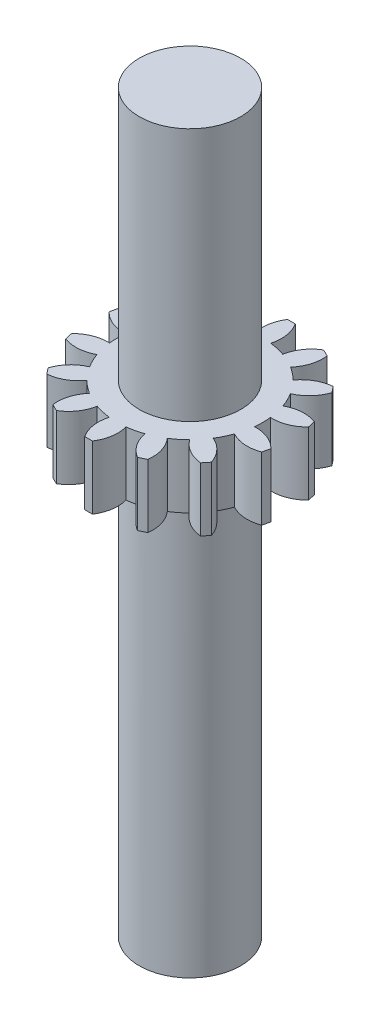
from build123d import *

# Parameters (mm, degrees)
SKETCH1_R                = 0.4
BOSS_EXTRUDE1_DEPTH      = 5
BOSS_EXTRUDE2_DEPTH      = 33
BOSS_EXTRUDE2_DEPTH_BACK = 5
SKETCH2_R                = 4
BOSS_EXTRUDE3_START      = 20
SKETCH3_R                = 4
BOSS_EXTRUDE3_DEPTH      = 20
CUT_EXTRUDE1_DEPTH       = 33


with BuildPart() as part:
    # Sketch1 → Boss-Extrude1 (new body)
    with BuildSketch(Plane(origin=(0, 0, 0), x_dir=(1, 0, 0), z_dir=(0, 1, 0))):
        with BuildLine():
            ThreePointArc((3.744900382, -7.069350828), (3.64692573, -5.891768521), (3.071904032, -4.859465672))
            ThreePointArc((3.071904032, -4.859465672), (3.584442871, -4.494749193), (4.054065768, -4.076217824))
            ThreePointArc((4.054065768, -4.076217824), (4.932532263, -4.866531521), (6.058788713, -5.224086459))
            ThreePointArc((6.058788713, -5.224086459), (6.25465186, -4.987918415), (6.441315028, -4.744413632))
            ThreePointArc((6.441315028, -4.744413632), (5.842109102, -3.725958242), (4.876133034, -3.045378078))
            ThreePointArc((4.876133034, -3.045378078), (5.179670022, -2.494397616), (5.421191676, -1.913552144))
            ThreePointArc((5.421191676, -1.913552144), (6.555566902, -2.244447854), (7.725426174, -2.077929362))
            ThreePointArc((7.725426174, -2.077929362), (7.799423297, -1.780167472), (7.861948235, -1.47978713))
            ThreePointArc((7.861948235, -1.47978713), (6.880191117, -0.822176238), (5.714584087, -0.628116006))
            ThreePointArc((5.714584087, -0.628116006), (5.749, 0), (5.714584087, 0.628116006))
            ThreePointArc((5.714584087, 0.628116006), (6.880191117, 0.822176238), (7.861948235, 1.47978713))
            ThreePointArc((7.861948235, 1.47978713), (7.799423297, 1.780167472), (7.725426174, 2.077929362))
            ThreePointArc((7.725426174, 2.077929362), (6.555566902, 2.244447854), (5.421191676, 1.913552144))
            ThreePointArc((5.421191676, 1.913552144), (5.179670022, 2.494397616), (4.876133034, 3.045378078))
            ThreePointArc((4.876133034, 3.045378078), (5.842109102, 3.725958242), (6.441315028, 4.744413632))
            ThreePointArc((6.441315028, 4.744413632), (6.25465186, 4.987918415), (6.058788713, 5.224086459))
            ThreePointArc((6.058788713, 5.224086459), (4.932532263, 4.866531521), (4.054065768, 4.076217824))
            ThreePointArc((4.054065768, 4.076217824), (3.584442871, 4.494749193), (3.071904032, 4.859465672))
            ThreePointArc((3.071904032, 4.859465672), (3.64692573, 5.891768521), (3.744900382, 7.069350828))
            ThreePointArc((3.744900382, 7.069350828), (3.471069913, 7.207750943), (3.192133841, 7.335549164))
            ThreePointArc((3.192133841, 7.335549164), (2.332549116, 6.524738937), (1.883982415, 5.431538572))
            ThreePointArc((1.883982415, 5.431538572), (1.279272849, 5.604860567), (0.659246762, 5.711076493))
            ThreePointArc((0.659246762, 5.711076493), (0.72942399, 6.890641786), (0.306762287, 7.994116393))
            ThreePointArc((0.306762287, 7.994116393), (0, 8), (-0.306762287, 7.994116393))
            ThreePointArc((-0.306762287, 7.994116393), (-0.72942399, 6.890641786), (-0.659246762, 5.711076493))
            ThreePointArc((-0.659246762, 5.711076493), (-1.279272849, 5.604860567), (-1.883982415, 5.431538572))
            ThreePointArc((-1.883982415, 5.431538572), (-2.332549116, 6.524738937), (-3.192133841, 7.335549164))
            ThreePointArc((-3.192133841, 7.335549164), (-3.471069913, 7.207750943), (-3.744900382, 7.069350828))
            ThreePointArc((-3.744900382, 7.069350828), (-3.64692573, 5.891768521), (-3.071904032, 4.859465672))
            ThreePointArc((-3.071904032, 4.859465672), (-3.584442871, 4.494749193), (-4.054065768, 4.076217824))
            ThreePointArc((-4.054065768, 4.076217824), (-4.932532263, 4.866531521), (-6.058788713, 5.224086459))
            ThreePointArc((-6.058788713, 5.224086459), (-6.25465186, 4.987918415), (-6.441315028, 4.744413632))
            ThreePointArc((-6.441315028, 4.744413632), (-5.842109102, 3.725958242), (-4.876133034, 3.045378078))
            ThreePointArc((-4.876133034, 3.045378078), (-5.179670022, 2.494397616), (-5.421191676, 1.913552144))
            ThreePointArc((-5.421191676, 1.913552144), (-6.555566902, 2.244447854), (-7.725426174, 2.077929362))
            ThreePointArc((-7.725426174, 2.077929362), (-7.799423297, 1.780167472), (-7.861948235, 1.47978713))
            ThreePointArc((-7.861948235, 1.47978713), (-6.880191117, 0.822176238), (-5.714584087, 0.628116006))
            ThreePointArc((-5.714584087, 0.628116006), (-5.749, 0), (-5.714584087, -0.628116006))
            ThreePointArc((-5.714584087, -0.628116006), (-6.880191117, -0.822176238), (-7.861948235, -1.47978713))
            ThreePointArc((-7.861948235, -1.47978713), (-7.799423297, -1.780167472), (-7.725426174, -2.077929362))
            ThreePointArc((-7.725426174, -2.077929362), (-6.555566902, -2.244447854), (-5.421191676, -1.913552144))
            ThreePointArc((-5.421191676, -1.913552144), (-5.179670022, -2.494397616), (-4.876133034, -3.045378078))
            ThreePointArc((-4.876133034, -3.045378078), (-5.842109102, -3.725958242), (-6.441315028, -4.744413632))
            ThreePointArc((-6.441315028, -4.744413632), (-6.25465186, -4.987918415), (-6.058788713, -5.224086459))
            ThreePointArc((-6.058788713, -5.224086459), (-4.932532263, -4.866531521), (-4.054065768, -4.076217824))
            ThreePointArc((-4.054065768, -4.076217824), (-3.584442871, -4.494749193), (-3.071904032, -4.859465672))
            ThreePointArc((-3.071904032, -4.859465672), (-3.64692573, -5.891768521), (-3.744900382, -7.069350828))
            ThreePointArc((-3.744900382, -7.069350828), (-3.471069913, -7.207750943), (-3.192133841, -7.335549164))
            ThreePointArc((-3.192133841, -7.335549164), (-2.332549116, -6.524738937), (-1.883982415, -5.431538572))
            ThreePointArc((-1.883982415, -5.431538572), (-1.279272849, -5.604860567), (-0.659246762, -5.711076493))
            ThreePointArc((-0.659246762, -5.711076493), (-0.72942399, -6.890641786), (-0.306762287, -7.994116393))
            ThreePointArc((-0.306762287, -7.994116393), (0, -8), (0.306762287, -7.994116393))
            ThreePointArc((0.306762287, -7.994116393), (0.72942399, -6.890641786), (0.659246762, -5.711076493))
            ThreePointArc((0.659246762, -5.711076493), (1.279272849, -5.604860567), (1.883982415, -5.431538572))
            ThreePointArc((1.883982415, -5.431538572), (2.332549116, -6.524738937), (3.192133841, -7.335549164))
            ThreePointArc((3.192133841, -7.335549164), (3.471069913, -7.207750943), (3.744900382, -7.069350828))
        make_face()
        with Locations(Location((0, 0, 0), (0, 0, 90))):
            Circle(SKETCH1_R, mode=Mode.SUBTRACT)
    extrude(amount=-BOSS_EXTRUDE1_DEPTH)

    # Sketch2 → Boss-Extrude2 (add, two sides: drawn at the far end of the back side and taken through both)
    with BuildSketch(Plane.XZ.offset(5).offset(-BOSS_EXTRUDE2_DEPTH_BACK)):
        with Locations(Location((0, 0, 0), (0, 0, 270))):
            Circle(SKETCH2_R)
    extrude(amount=BOSS_EXTRUDE2_DEPTH + BOSS_EXTRUDE2_DEPTH_BACK)

    # Sketch3 → Boss-Extrude3 (add)
    with BuildSketch(Plane(origin=(0, 0, 0), x_dir=(1, 0, 0), z_dir=(0, 1, 0)).offset(BOSS_EXTRUDE3_START)):
        with Locations(Location((0, 0, 0), (0, 0, 90))):
            Circle(SKETCH3_R)
    extrude(amount=-BOSS_EXTRUDE3_DEPTH)

    # Sketch4 → Cut-Extrude1 (cut)
    with BuildSketch(Plane.XZ.offset(38)):
        with BuildLine():
            Line((-2, -1.5), (2, -1.5))
            ThreePointArc((2, -1.5), (2.5, 0), (2, 1.5))
            Line((2, 1.5), (-2, 1.5))
            ThreePointArc((-2, 1.5), (-2.5, 0), (-2, -1.5))
        make_face()
    extrude(amount=-CUT_EXTRUDE1_DEPTH, mode=Mode.SUBTRACT)


solid = part.part
